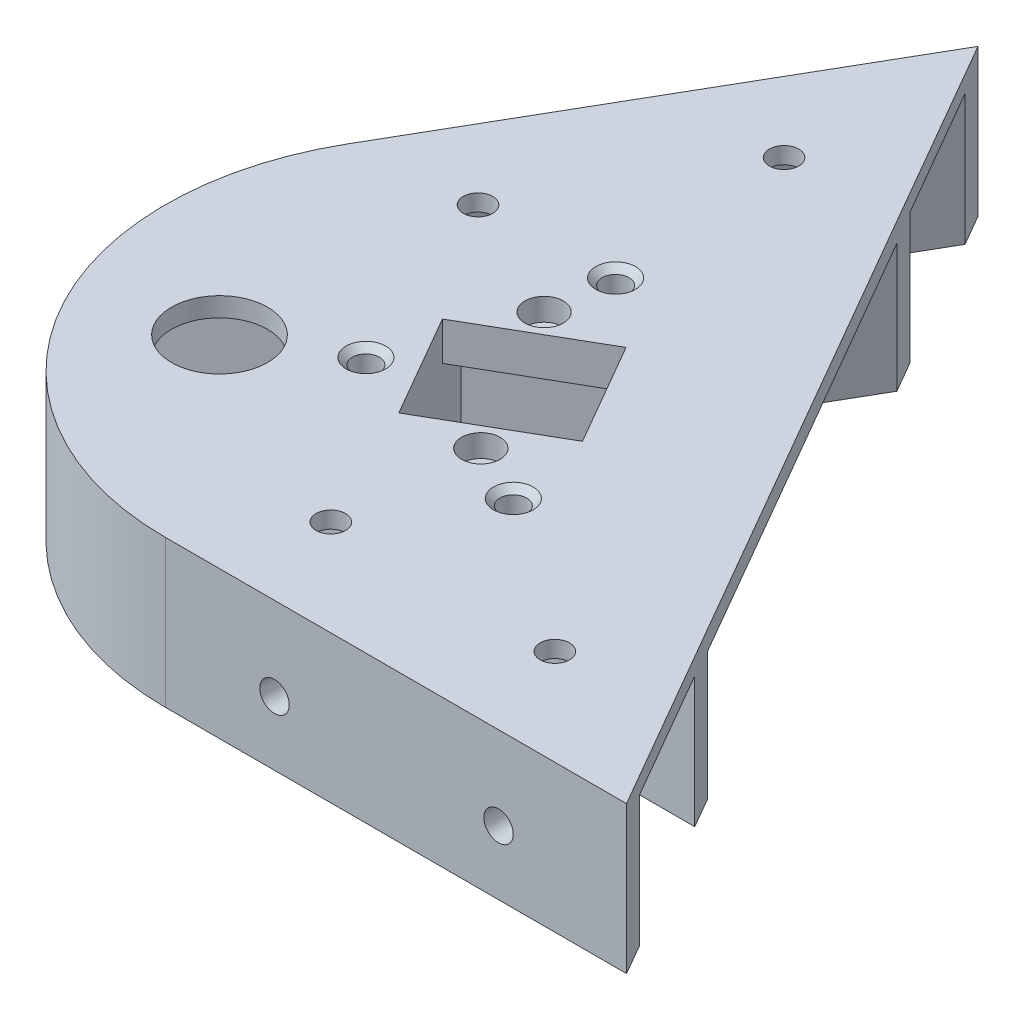
from build123d import *

# Parameters (mm, degrees)
BOSS_EXTRUDE1_DEPTH      = 23
SKETCH2_W                = 100.4
SKETCH2_H                = 20.4
CUT_EXTRUDE2_DEPTH       = 20.4
CUT_EXTRUDE3_DEPTH       = 20
SKETCH7_R                = 2.3
CUT_EXTRUDE6_DEPTH       = 10
SKETCH8_R                = 2.3
CUT_EXTRUDE7_DEPTH       = 10
FILLET3_R                = 45
CUT_EXTRUDE11_DEPTH      = 200.759855827
CUT_EXTRUDE11_DEPTH_BACK = 200.759855827
CUT_EXTRUDE10_DEPTH      = 20
SKETCH32_R               = 2.3
CUT_EXTRUDE18_DEPTH      = 10
SKETCH33_R               = 2.3
CUT_EXTRUDE19_DEPTH      = 10
SKETCH34_R               = 2.3
CUT_EXTRUDE20_DEPTH      = 149.465956609
SKETCH35_R               = 4
CUT_EXTRUDE21_DEPTH      = 152.333845776
SKETCH36_R               = 2.1
CUT_EXTRUDE22_DEPTH      = 200.759855838
SKETCH38_R               = 2.3
CUT_EXTRUDE24_DEPTH      = 10
BOSS_EXTRUDE2_DEPTH      = 6
SKETCH40_R               = 1.65
CUT_EXTRUDE25_DEPTH      = 200.158228561
SKETCH41_R               = 3
CUT_EXTRUDE26_DEPTH      = 3.5
SKETCH42_R               = 2.1
CUT_EXTRUDE27_DEPTH      = 200.759855838
CHAMFER2_SIZE            = 1
SKETCH43_R               = 2.1
CUT_EXTRUDE28_DEPTH      = 15
CHAMFER3_SIZE            = 1
SKETCH45_R               = 2.3
CUT_EXTRUDE29_DEPTH      = 130.123625221
SKETCH46_R               = 4
CUT_EXTRUDE30_DEPTH      = 127.307236488
SKETCH47_R               = 7.5
CUT_EXTRUDE31_DEPTH      = 10


with BuildPart() as part:
    # Sketch1 → Boss-Extrude1 (new body)
    with BuildSketch(Plane(origin=(0, 0, 0), x_dir=(1, 0, 0), z_dir=(0, 1, 0))):
        Polygon((0, 0), (150, 0), (75, 129.903810568), align=None)
    extrude(amount=BOSS_EXTRUDE1_DEPTH)

    # Sketch2 → Cut-Extrude2 (cut)
    with BuildSketch(Plane(origin=(0, 0, 0), x_dir=(1, 0, 0), z_dir=(0, 1, 0))):
        Polygon((108.923840175, 138.261625339), (58.723840175, 51.312674799), (41.056921938, 61.512674799), (91.256921938, 148.461625339), align=None)
        with Locations((124, 15)):
            Rectangle(SKETCH2_W, SKETCH2_H)
    extrude(amount=CUT_EXTRUDE2_DEPTH, mode=Mode.SUBTRACT)

    # Sketch4 → Cut-Extrude3 (cut)
    with BuildSketch(Plane(origin=(0, 0, 0), x_dir=(1, 0, 0), z_dir=(0, 1, 0))):
        Polygon((58.515583945, 45.561933634), (40.848665708, 35.361933634), (51.048665708, 17.695015397), (68.715583945, 27.895015397), align=None)
    extrude(amount=CUT_EXTRUDE3_DEPTH, mode=Mode.SUBTRACT)

    # Sketch7 → Cut-Extrude6 (cut)
    with BuildSketch(Plane(origin=(0, 0, 0), x_dir=(-0.4999999999999978, 0, 0.86602540378444), z_dir=(-0.86602540378444, 0, -0.4999999999999978))):
        with Locations((-130, 10)):
            Circle(SKETCH7_R)
        with Locations((-95, 10)):
            Circle(SKETCH7_R)
    extrude(amount=-CUT_EXTRUDE6_DEPTH, mode=Mode.SUBTRACT)

    # Sketch8 → Cut-Extrude7 (cut)
    with BuildSketch(Plane.XY):
        with Locations((130, 10)):
            Circle(SKETCH8_R)
        with Locations((95, 10)):
            Circle(SKETCH8_R)
    extrude(amount=-CUT_EXTRUDE7_DEPTH, mode=Mode.SUBTRACT)

    # Fillet3
    fillet3_edges = [part.edges().sort_by_distance(p)[0] for p in [
        (0, 11.5, 0),
    ]]
    fillet(fillet3_edges, radius=FILLET3_R)

    # Sketch22 → Cut-Extrude11 (cut, two sides: drawn at the far end of the back side and taken through both)
    with BuildSketch(Plane.XZ.offset(-CUT_EXTRUDE11_DEPTH_BACK)):
        Polygon((83.35335133, -28.147760515), (66.05335133, -58.112239485), (84.23988481, -68.612239485), (101.53988481, -38.647760515), align=None)
    extrude(amount=CUT_EXTRUDE11_DEPTH + CUT_EXTRUDE11_DEPTH_BACK, mode=Mode.SUBTRACT)

    # Sketch21 → Cut-Extrude10 (cut)
    with BuildSketch(Plane.XZ):
        Polygon((132.679491924, -30), (109.996773286, -30), (80.979148757, -80.26), (92.320508076, -99.903810568), align=None)
    extrude(amount=-CUT_EXTRUDE10_DEPTH, mode=Mode.SUBTRACT)

    # Sketch32 → Cut-Extrude18 (cut)
    with BuildSketch(Plane(origin=(0, 0, -30), x_dir=(-1, 0, 0), z_dir=(0, 0, -1))):
        with Locations((-121.338132605, 10)):
            Circle(SKETCH32_R)
    extrude(amount=-CUT_EXTRUDE18_DEPTH, mode=Mode.SUBTRACT)

    # Sketch33 → Cut-Extrude19 (cut)
    with BuildSketch(Plane(origin=(25.980762114, 0, 15), x_dir=(0.4999999999999997, 0, -0.8660254037844388), z_dir=(0.8660254037844389, 0, 0.49999999999999983))):
        with Locations((121.338132605, 10)):
            Circle(SKETCH33_R)
    extrude(amount=-CUT_EXTRUDE19_DEPTH, mode=Mode.SUBTRACT)

    # Sketch34 → Cut-Extrude20 (cut, through all)
    with BuildSketch(Plane(origin=(45.948665708, 0, -26.528474516), x_dir=(-0.5000000000000001, 0, -0.8660254037844386), z_dir=(0.8660254037844386, 0, -0.5000000000000001))):
        with Locations((0, 10)):
            Circle(SKETCH34_R)
    extrude(amount=-CUT_EXTRUDE20_DEPTH, mode=Mode.SUBTRACT)

    # Sketch35 → Cut-Extrude21 (cut, through all)
    with BuildSketch(Plane(origin=(43.350589497, 0, -25.028474516), x_dir=(-0.5000000000000001, 0, -0.8660254037844386), z_dir=(0.8660254037844386, 0, -0.5000000000000001))):
        with Locations((0, 10)):
            Circle(SKETCH35_R)
    extrude(amount=-CUT_EXTRUDE21_DEPTH, mode=Mode.SUBTRACT)

    # Sketch36 → Cut-Extrude22 (cut, through all)
    with BuildSketch(Plane(origin=(0, 23, 0), x_dir=(1, 0, 0), z_dir=(0, 1, 0))):
        with Locations(Location((69.282032303, 40, 0), (0, 0, 270))):
            Circle(SKETCH36_R)
    extrude(amount=-CUT_EXTRUDE22_DEPTH, mode=Mode.SUBTRACT)

    # Sketch38 → Cut-Extrude24 (cut)
    with BuildSketch(Plane.XZ.offset(-20.4)):
        with Locations(Location((88.8, -15, 0), (0, 0, 270))):
            Circle(SKETCH38_R)
        with Locations(Location((123.8, -15, 0), (0, 0, 270))):
            Circle(SKETCH38_R)
        with Locations(Location((57.390381057, -69.403055856, 0), (0, 0, 270))):
            Circle(SKETCH38_R)
        with Locations(Location((74.890381057, -99.713944989, 0), (0, 0, 270))):
            Circle(SKETCH38_R)
    extrude(amount=-CUT_EXTRUDE24_DEPTH, mode=Mode.SUBTRACT)

    # Sketch39 → Boss-Extrude2 (add)
    with BuildSketch(Plane(origin=(0, 23, 0), x_dir=(1, 0, 0), z_dir=(0, 1, 0))):
        Polygon((66.05335133, 58.112239485), (84.23988481, 68.612239485), (88.23988481, 61.684036255), (70.05335133, 51.184036255), align=None)
        Polygon((101.53988481, 38.647760515), (83.35335133, 28.147760515), (79.35335133, 35.075963745), (97.53988481, 45.575963745), align=None)
    extrude(amount=-BOSS_EXTRUDE2_DEPTH)

    # Sketch40 → Cut-Extrude25 (cut, through all)
    with BuildSketch(Plane.XZ.offset(-17)):
        with Locations(Location((90.54661807, -36.688657049, 0), (0, 0, 270))):
            Circle(SKETCH40_R)
        with Locations(Location((77.04661807, -60.071342951, 0), (0, 0, 270))):
            Circle(SKETCH40_R)
    extrude(amount=-CUT_EXTRUDE25_DEPTH, mode=Mode.SUBTRACT)

    # Sketch41 → Cut-Extrude26 (cut)
    with BuildSketch(Plane(origin=(0, 23, 0), x_dir=(1, 0, 0), z_dir=(0, 1, 0))):
        with Locations(Location((77.04661807, 60.071342951, 0), (0, 0, 270))):
            Circle(SKETCH41_R)
        with Locations(Location((90.54661807, 36.688657049, 0), (0, 0, 270))):
            Circle(SKETCH41_R)
    extrude(amount=-CUT_EXTRUDE26_DEPTH, mode=Mode.SUBTRACT)

    # Sketch42 → Cut-Extrude27 (cut, through all)
    with BuildSketch(Plane(origin=(0, 23, 0), x_dir=(1, 0, 0), z_dir=(0, 1, 0))):
        with Locations(Location((99.860934211, 32.446784409, 0), (0, 0, 270))):
            Circle(SKETCH42_R)
        with Locations(Location((78.030206675, 70.258713668, 0), (0, 0, 270))):
            Circle(SKETCH42_R)
    extrude(amount=-CUT_EXTRUDE27_DEPTH, mode=Mode.SUBTRACT)

    # Chamfer2
    chamfer2_edges = [part.edges().sort_by_distance(p)[0] for p in [
        (69.282032303, 23, -42.1),
        (99.860934211, 23, -34.546784409),
        (78.030206675, 23, -72.358713668),
    ]]
    chamfer(chamfer2_edges, length=CHAMFER2_SIZE)

    # Sketch43 → Cut-Extrude28 (cut)
    with BuildSketch(Plane.XZ):
        with Locations(Location((64.382124827, -15.000786763, 0), (0, 0, 270))):
            Circle(SKETCH43_R)
        with Locations(Location((45.182124827, -48.256162268, 0), (0, 0, 270))):
            Circle(SKETCH43_R)
    extrude(amount=-CUT_EXTRUDE28_DEPTH, mode=Mode.SUBTRACT)

    # Chamfer3
    chamfer3_edges = [part.edges().sort_by_distance(p)[0] for p in [
        (64.382124827, 0, -12.900786763),
        (45.182124827, 0, -46.156162268),
    ]]
    chamfer(chamfer3_edges, length=CHAMFER3_SIZE)

    # Sketch45 → Cut-Extrude29 (cut, through all)
    with BuildSketch(Plane(origin=(63.615583945, 0, -36.728474516), x_dir=(0.5, 0, 0.8660254037844386), z_dir=(-0.8660254037844387, 0, 0.5000000000000001))):
        with Locations(Location((0, 10, 0), (0, 0, 180))):
            Circle(SKETCH45_R)
    extrude(amount=-CUT_EXTRUDE29_DEPTH, mode=Mode.SUBTRACT)

    # Sketch46 → Cut-Extrude30 (cut, through all)
    with BuildSketch(Plane(origin=(66.213660157, 0, -38.228474516), x_dir=(0.5, 0, 0.8660254037844386), z_dir=(-0.8660254037844387, 0, 0.5000000000000001))):
        with Locations(Location((0, 10, 0), (0, 0, 180))):
            Circle(SKETCH46_R)
    extrude(amount=-CUT_EXTRUDE30_DEPTH, mode=Mode.SUBTRACT)

    # Sketch47 → Cut-Extrude31 (cut)
    with BuildSketch(Plane.XZ.offset(-20)):
        with Locations(Location((54.782124827, -31.628474516, 0), (0, 0, 270))):
            Circle(SKETCH47_R)
    extrude(amount=-CUT_EXTRUDE31_DEPTH, mode=Mode.SUBTRACT)


solid = part.part
